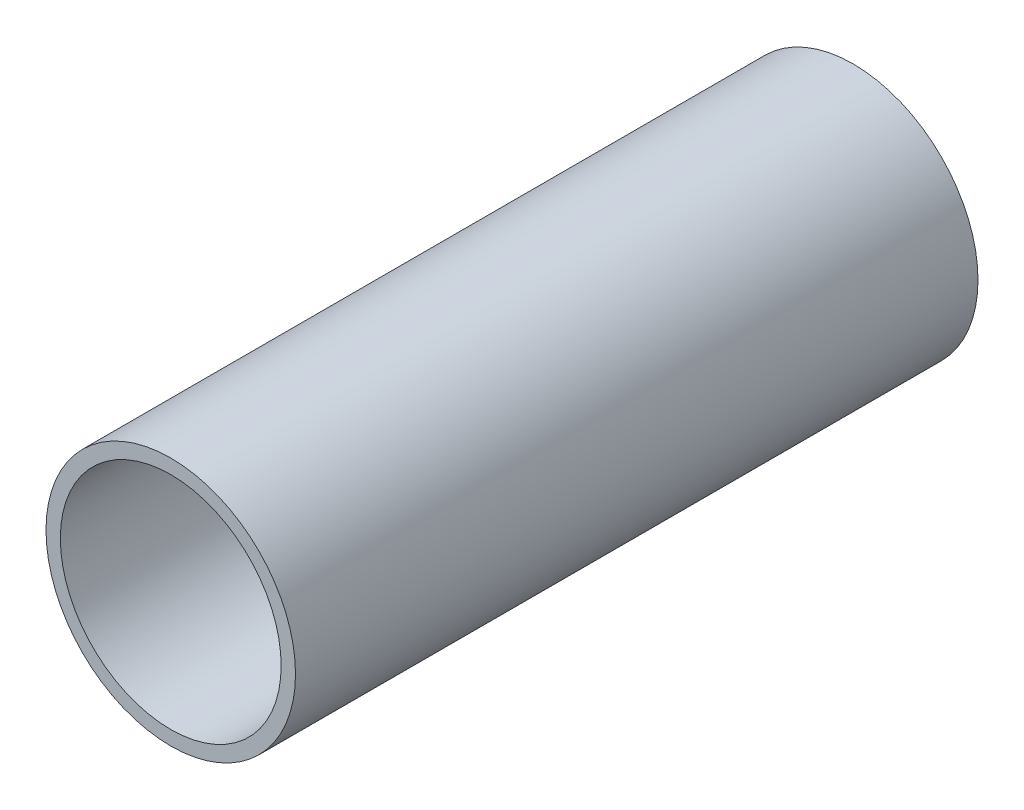
from build123d import *

# Parameters (mm, degrees)
SKETCH5_R           = 87
SKETCH5_R_2         = 77
BOSS_EXTRUDE3_DEPTH = 476


with BuildPart() as part:
    # Sketch5 → Boss-Extrude3 (new body)
    with BuildSketch(Plane.XY):
        with Locations(Location((0, 0, 0), (0, 0, 180))):
            Circle(SKETCH5_R)
        with Locations(Location((0, 0, 0), (0, 0, 180))):
            Circle(SKETCH5_R_2, mode=Mode.SUBTRACT)
    extrude(amount=BOSS_EXTRUDE3_DEPTH)


solid = part.part
